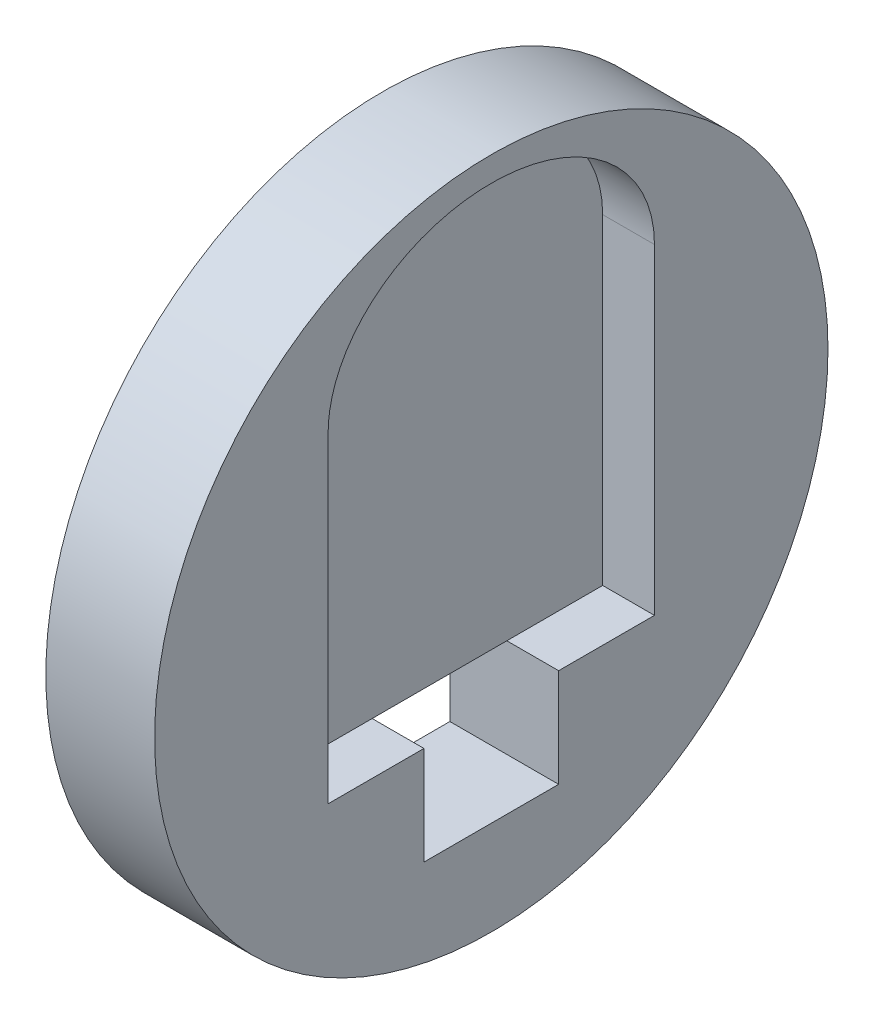
from build123d import *

# Parameters (mm, degrees)
SKETCH2_R                = 32.5
BOSS_EXTRUDE1_DEPTH      = 10.5
SKETCH3_W                = 13
SKETCH3_H                = 4.5
SKETCH3_H_2              = 5
CUT_EXTRUDE1_DEPTH       = 48.146049675
SKETCH3_3_RX             = 15.75
SKETCH3_3_RY             = 13
CUT_EXTRUDE6_DEPTH       = 5
EXTRUDE_THIN1_DEPTH      = 4
EXTRUDE_THIN1_DEPTH_BACK = 5.5
BOSS_EXTRUDE8_DEPTH      = 4
BOSS_EXTRUDE8_DEPTH_BACK = 5.5
CUT_EXTRUDE5_DEPTH       = 3.5


with BuildPart() as part:
    # Sketch2 → Boss-Extrude1 (new body)
    with BuildSketch(Plane(origin=(0, 0, 0), x_dir=(0, 0, -1), z_dir=(1, 0, 0))):
        Circle(SKETCH2_R)
    extrude(amount=-BOSS_EXTRUDE1_DEPTH)

    # Sketch3 → Cut-Extrude1 (cut, through all)
    with BuildSketch(Plane(origin=(0, 0, 0), x_dir=(0, 0, -1), z_dir=(1, 0, 0))):
        with Locations((0, -21.145823157)):
            Rectangle(SKETCH3_W, SKETCH3_H)
        with Locations((0, -16.395823157)):
            Rectangle(SKETCH3_W, SKETCH3_H_2)
    extrude(amount=-CUT_EXTRUDE1_DEPTH, mode=Mode.SUBTRACT)

    # Sketch3<3> → Cut-Extrude6 (cut)
    with BuildSketch(Plane(origin=(0, 0, 0), x_dir=(0, 0, -1), z_dir=(1, 0, 0))):
        with BuildLine():
            add(Edge.make_bspline(
                [(-15.75, 17.104176843), (-15.75, 4.104176843), (0, 4.104176843), (15.75, 4.104176843), (15.75, 17.104176843)],
                knots=[3.141592654, 3.141592654, 3.141592654, 4.71238898, 4.71238898, 6.283185307, 6.283185307, 6.283185307], degree=2, weights=[1, 0.707106781, 1, 0.707106781, 1]))
            Line((-15.75, 17.104176843), (-15.75, -13.895823157))
            Line((-15.75, -13.895823157), (-6.5, -13.895823157))
            Line((-6.5, -13.895823157), (6.5, -13.895823157))
            Line((6.5, -13.895823157), (15.75, -13.895823157))
            Line((15.75, -13.895823157), (15.75, 17.104176843))
        make_face()
        with Locations((0, 17.104176843)):
            Ellipse(SKETCH3_3_RX, SKETCH3_3_RY)
    extrude(amount=-CUT_EXTRUDE6_DEPTH, mode=Mode.SUBTRACT)

    # Sketch10 → Cut-Extrude5 (cut)
    with BuildSketch(Plane.ZY.offset(10.5)):
        with BuildLine():
            Line((1.5, -1), (1.5, 0))
            ThreePointArc((1.5, 0), (0, 1.5), (-1.5, 0))
            Line((-1.5, 0), (-1.5, -1))
            Line((-1.5, -1), (1.5, -1))
        make_face()
    extrude(amount=-CUT_EXTRUDE5_DEPTH, mode=Mode.SUBTRACT)


with BuildPart() as body_2:
    # Sketch5 → Extrude-Thin1 (new, two sides: drawn at the far end of the back side and taken through both)
    with BuildSketch(Plane.ZY.offset(10.5).offset(-EXTRUDE_THIN1_DEPTH_BACK)):
        with BuildLine():
            Line((-3.5, 0), (-3.5, -3))
            Line((-3.5, -3), (3.5, -3))
            Line((3.5, -3), (3.5, 0))
            ThreePointArc((3.5, 0), (0, 3.5), (-3.5, 0))
        make_face()
        with BuildLine():
            Line((-1.5, 0), (-1.5, -1))
            Line((-1.5, -1), (1.5, -1))
            Line((1.5, -1), (1.5, 0))
            ThreePointArc((1.5, 0), (0, 1.5), (-1.5, 0))
        make_face(mode=Mode.SUBTRACT)
    extrude(amount=EXTRUDE_THIN1_DEPTH + EXTRUDE_THIN1_DEPTH_BACK)


with BuildPart() as body_3:
    # Sketch5<4> → Boss-Extrude8 (new, two sides: drawn at the far end of the back side and taken through both)
    with BuildSketch(Plane.ZY.offset(10.5).offset(-BOSS_EXTRUDE8_DEPTH_BACK)):
        Polygon((-1.5, -1), (-1.5, 0), (-1.5, 1), (-5, 1), (-5, -1.5), (-1, -1.5), (0, -1.5), (0, -1), align=None)
        with BuildLine():
            Line((-1.5, 1), (-1.5, 0))
            ThreePointArc((-1.5, 0), (-1.060660172, 1.060660172), (0, 1.5))
            Line((0, 1.5), (1, 1.5))
            Line((1, 1.5), (1, 5))
            Line((1, 5), (-1.5, 5))
            Line((-1.5, 5), (-1.5, 1))
        make_face()
        with BuildLine():
            Line((1, 1.5), (0, 1.5))
            ThreePointArc((0, 1.5), (1.060660172, 1.060660172), (1.5, 0))
            Line((1.5, 0), (1.5, -1))
            Line((1.5, -1), (5, -1))
            Line((5, -1), (5, 1.5))
            Line((5, 1.5), (1, 1.5))
        make_face()
        Polygon((1.5, -1.5), (0, -1.5), (-1, -1.5), (-1, -5), (1.5, -5), align=None)
    extrude(amount=BOSS_EXTRUDE8_DEPTH + BOSS_EXTRUDE8_DEPTH_BACK)


solid = Compound([part.part, body_2.part, body_3.part])
